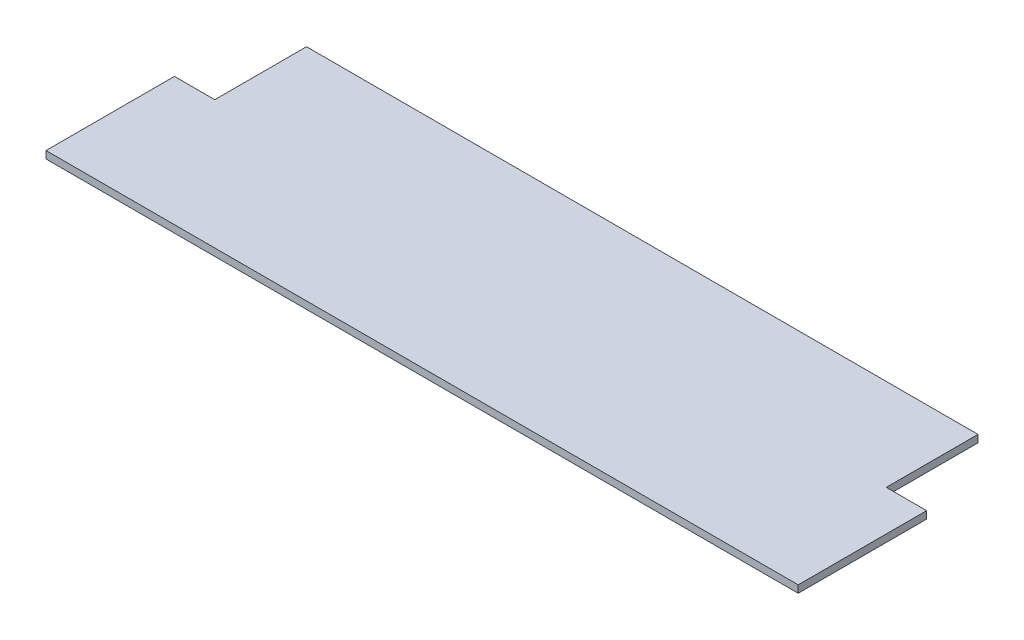
from build123d import *

# Parameters (mm, degrees)
SKETCH1_W           = 410
SKETCH1_H           = 120
BOSS_EXTRUDE1_DEPTH = 4
CUT_EXTRUDE1_REACH  = 215.638
SKETCH2_W           = 50.170218681
SKETCH2_H           = 70.735007755


with BuildPart() as part:
    # Sketch1 → Boss-Extrude1 (new body)
    with BuildSketch(Plane(origin=(0, 0, 0), x_dir=(1, 0, 0), z_dir=(0, 1, 0))):
        Rectangle(SKETCH1_W, SKETCH1_H)
    extrude(amount=BOSS_EXTRUDE1_DEPTH)

    # Sketch2 → Cut-Extrude1 (cut, up to next)
    with BuildSketch(Plane(origin=(0, 4, 0), x_dir=(1, 0, 0), z_dir=(0, 1, 0)), mode=Mode.PRIVATE) as cut_extrude1_sk1:
        with Locations((208.085109341, 45.367503877)):
            Rectangle(SKETCH2_W, SKETCH2_H)
    cut_extrude1_tool1 = extrude(cut_extrude1_sk1.sketch, amount=-CUT_EXTRUDE1_REACH, mode=Mode.PRIVATE) & part.part
    # Sketch2 → Cut-Extrude1 (cut, up to next)
    with BuildSketch(Plane(origin=(0, 4, 0), x_dir=(1, 0, 0), z_dir=(0, 1, 0)), mode=Mode.PRIVATE) as cut_extrude1_sk2:
        with Locations((-208.085109341, 45.367503877)):
            Rectangle(SKETCH2_W, SKETCH2_H)
    cut_extrude1_tool2 = extrude(cut_extrude1_sk2.sketch, amount=-CUT_EXTRUDE1_REACH, mode=Mode.PRIVATE) & part.part
    add(cut_extrude1_tool1.solids().sort_by_distance((208.085109, 4, -45.367504))[0], mode=Mode.SUBTRACT)
    add(cut_extrude1_tool2.solids().sort_by_distance((-208.085109, 4, -45.367504))[0], mode=Mode.SUBTRACT)


solid = part.part
